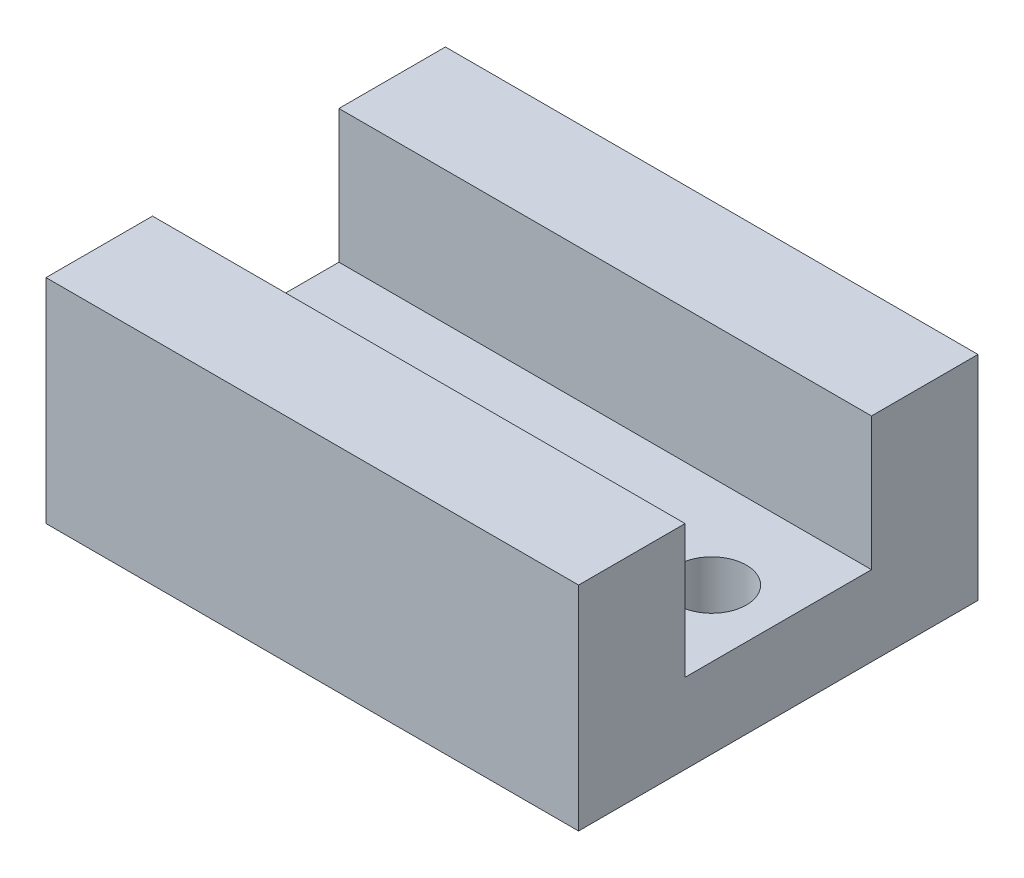
from build123d import *

# Parameters (mm, degrees)
SKETCH_1_W      = 20
SKETCH_1_H      = 15
SKETCH_1_R      = 1.3
EXTRUDE_1_DEPTH = 3
SKETCH_2_W      = 20
SKETCH_2_H      = 4
EXTRUDE_2_DEPTH = 5


with BuildPart() as part:
    # 草图1 → 凸台-拉伸1 (new body)
    with BuildSketch(Plane(origin=(0, 0, 0), x_dir=(1, 0, 0), z_dir=(0, 1, 0))):
        Rectangle(SKETCH_1_W, SKETCH_1_H)
        with Locations(Location((7.5, 0, 0), (0, 0, 270))):
            Circle(SKETCH_1_R, mode=Mode.SUBTRACT)
        with Locations(Location((-7.5, 0, 0), (0, 0, 270))):
            Circle(SKETCH_1_R, mode=Mode.SUBTRACT)
    extrude(amount=EXTRUDE_1_DEPTH)

    # 草图2 → 凸台-拉伸2 (add)
    with BuildSketch(Plane(origin=(0, 3, 0), x_dir=(1, 0, 0), z_dir=(0, 1, 0))):
        with Locations((0, 5.5)):
            Rectangle(SKETCH_2_W, SKETCH_2_H)
        with Locations((0, -5.5)):
            Rectangle(SKETCH_2_W, SKETCH_2_H)
    extrude(amount=EXTRUDE_2_DEPTH)


solid = part.part
